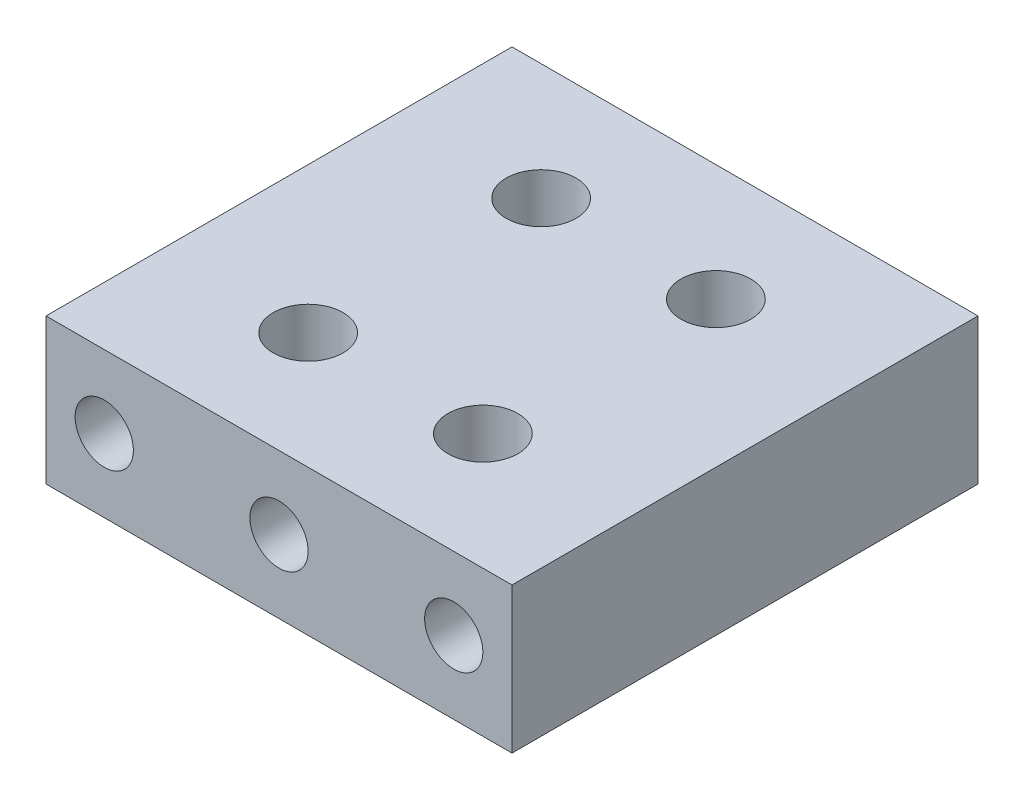
from build123d import *

# Parameters (mm, degrees)
SKETCH1_W                 = 50.8
SKETCH1_H                 = 50.8
BOSS_EXTRUDE1_DEPTH       = 15.875
SKETCH2_R                 = 3.175
CUT_EXTRUDE1_DEPTH        = 59.973007597
TAP_DRILL_FOR_8_32_TAP1_D = 3.4544
SKETCH5_R                 = 3.81
CUT_EXTRUDE2_DEPTH        = 6.35


with BuildPart() as part:
    # Sketch1 → Boss-Extrude1 (new body)
    with BuildSketch(Plane(origin=(0, 0, 0), x_dir=(1, 0, 0), z_dir=(0, 1, 0))):
        Rectangle(SKETCH1_W, SKETCH1_H)
    extrude(amount=BOSS_EXTRUDE1_DEPTH)

    # Sketch2 → Cut-Extrude1 (cut, through all)
    with BuildSketch(Plane.XY.offset(25.4)):
        with Locations((-19.05, 7.9375)):
            Circle(SKETCH2_R)
        with Locations((0, 7.9375)):
            Circle(SKETCH2_R)
        with Locations((19.05, 7.9375)):
            Circle(SKETCH2_R)
    extrude(amount=-CUT_EXTRUDE1_DEPTH, mode=Mode.SUBTRACT)

    # Tap Drill for #8-32 Tap1 (through all)
    with Locations(Plane(origin=(0, 15.875, 0), x_dir=(1, 0, 0), z_dir=(0, 1, 0))):
        with Locations((-9.525, -12.7), (-9.525, 12.7), (9.525, 12.7), (9.525, -12.7)):
            Hole(TAP_DRILL_FOR_8_32_TAP1_D / 2)

    # Sketch5 → Cut-Extrude2 (cut)
    with BuildSketch(Plane(origin=(0, 15.875, 0), x_dir=(1, 0, 0), z_dir=(0, 1, 0))):
        with Locations(Location((-9.525, 12.7, 0), (0, 0, 270))):
            Circle(SKETCH5_R)
        with Locations(Location((9.525, 12.7, 0), (0, 0, 270))):
            Circle(SKETCH5_R)
        with Locations(Location((9.525, -12.7, 0), (0, 0, 270))):
            Circle(SKETCH5_R)
        with Locations(Location((-9.525, -12.7, 0), (0, 0, 270))):
            Circle(SKETCH5_R)
    extrude(amount=-CUT_EXTRUDE2_DEPTH, mode=Mode.SUBTRACT)


solid = part.part
